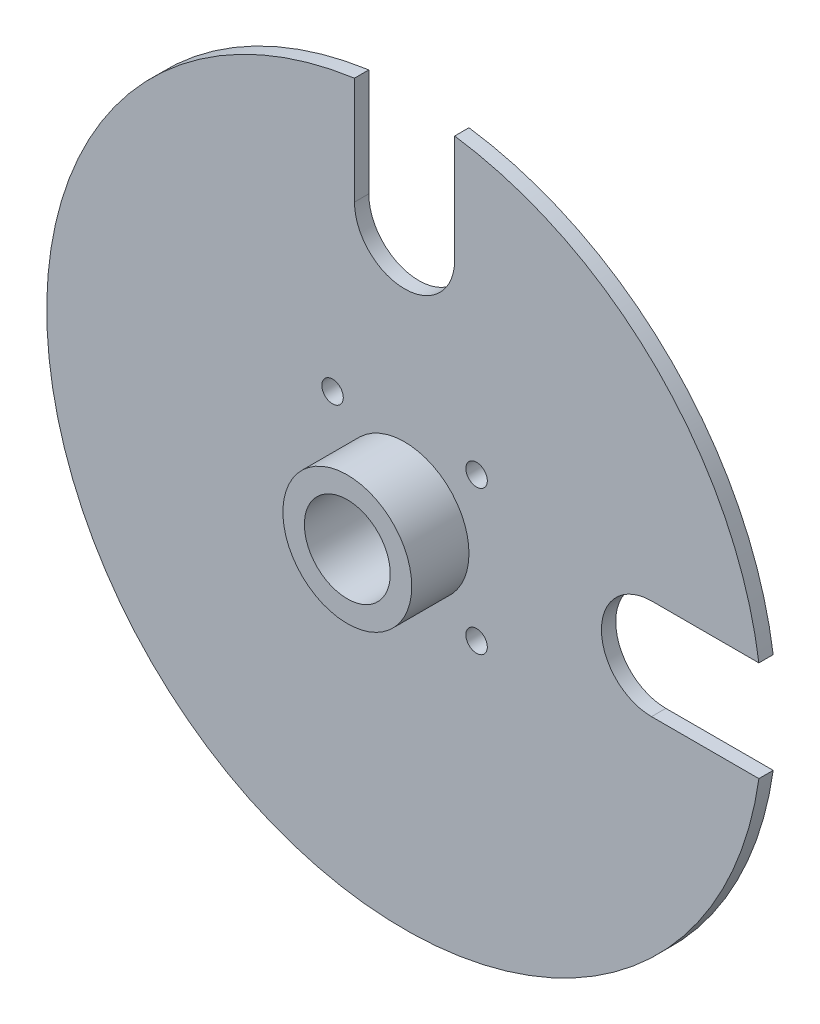
from build123d import *

# Parameters (mm, degrees)
SKETCH1_R               = 20
SKETCH1_R_2             = 6
SKETCH1_R_3             = 1.5
BOSS_EXTRUDE1_DEPTH     = 5
SKETCH2_R               = 9
SKETCH2_R_2             = 6
BOSS_EXTRUDE2_DEPTH     = 10
SKETCH3_R               = 50
SKETCH3_R_2             = 6
BOSS_EXTRUDE3_DEPTH     = 2
CUT_EXTRUDE1_START      = -2
CUT_EXTRUDE1_DEPTH      = 2
CUT_EXTRUDE2_DEPTH      = 73.284161474
CUT_EXTRUDE2_DEPTH_BACK = 73.284161474
SKETCH5_R               = 1.5


with BuildPart() as part:
    # Sketch1 → Boss-Extrude1 (new body)
    with BuildSketch(Plane.XY):
        Circle(SKETCH1_R)
        Circle(SKETCH1_R_2, mode=Mode.SUBTRACT)
        with Locations((-10.061951403, 10.061951403)):
            Circle(SKETCH1_R_3, mode=Mode.SUBTRACT)
        with Locations(Location((10.061951403, 10.061951403, 0), (0, 0, 180))):
            Circle(SKETCH1_R_3, mode=Mode.SUBTRACT)
        with Locations((10.061951403, -10.061951403)):
            Circle(SKETCH1_R_3, mode=Mode.SUBTRACT)
        with Locations(Location((-10.061951403, -10.061951403, 0), (0, 0, 180))):
            Circle(SKETCH1_R_3, mode=Mode.SUBTRACT)
    extrude(amount=BOSS_EXTRUDE1_DEPTH)

    # Sketch2 → Boss-Extrude2 (add)
    with BuildSketch(Plane.XY.offset(5)):
        Circle(SKETCH2_R)
        Circle(SKETCH2_R_2, mode=Mode.SUBTRACT)
    extrude(amount=BOSS_EXTRUDE2_DEPTH)

    # Sketch3 → Boss-Extrude3 (add)
    with BuildSketch(Plane.XY.offset(5)):
        Circle(SKETCH3_R)
        Circle(SKETCH3_R_2, mode=Mode.SUBTRACT)
    extrude(amount=BOSS_EXTRUDE3_DEPTH)

    # Sketch4 → Cut-Extrude1 (cut)
    with BuildSketch(Plane.XY.offset(7).offset(CUT_EXTRUDE1_START)):
        with BuildLine():
            Line((-7, 49.507575178), (-7, 34.507575178))
            ThreePointArc((-7, 34.507575178), (0, 27.507575178), (7, 34.507575178))
            Line((7, 34.507575178), (7, 49.507575178))
            ThreePointArc((7, 49.507575178), (0, 50), (-7, 49.507575178))
        make_face()
        with BuildLine():
            Line((49.507575178, -7), (34.507575178, -7))
            ThreePointArc((34.507575178, -7), (27.507575178, 0), (34.507575178, 7))
            Line((34.507575178, 7), (49.507575178, 7))
            ThreePointArc((49.507575178, 7), (50, 0), (49.507575178, -7))
        make_face()
    extrude(amount=CUT_EXTRUDE1_DEPTH, mode=Mode.SUBTRACT)

    # Sketch5 → Cut-Extrude2 (cut, two sides: drawn at the far end of the back side and taken through both)
    with BuildSketch(Plane(origin=(0, 0, 0), x_dir=(-1, 0, 0), z_dir=(0, 0, -1)).offset(-CUT_EXTRUDE2_DEPTH_BACK)):
        with Locations((-10.061951403, 10.061951403)):
            Circle(SKETCH5_R)
        with Locations(Location((-10.061951403, -10.061951403, 0), (0, 0, 180))):
            Circle(SKETCH5_R)
        with Locations(Location((10.061951403, 10.061951403, 0), (0, 0, 180))):
            Circle(SKETCH5_R)
        with Locations((10.061951403, -10.061951403)):
            Circle(SKETCH5_R)
    extrude(amount=CUT_EXTRUDE2_DEPTH + CUT_EXTRUDE2_DEPTH_BACK, mode=Mode.SUBTRACT)


solid = part.part
